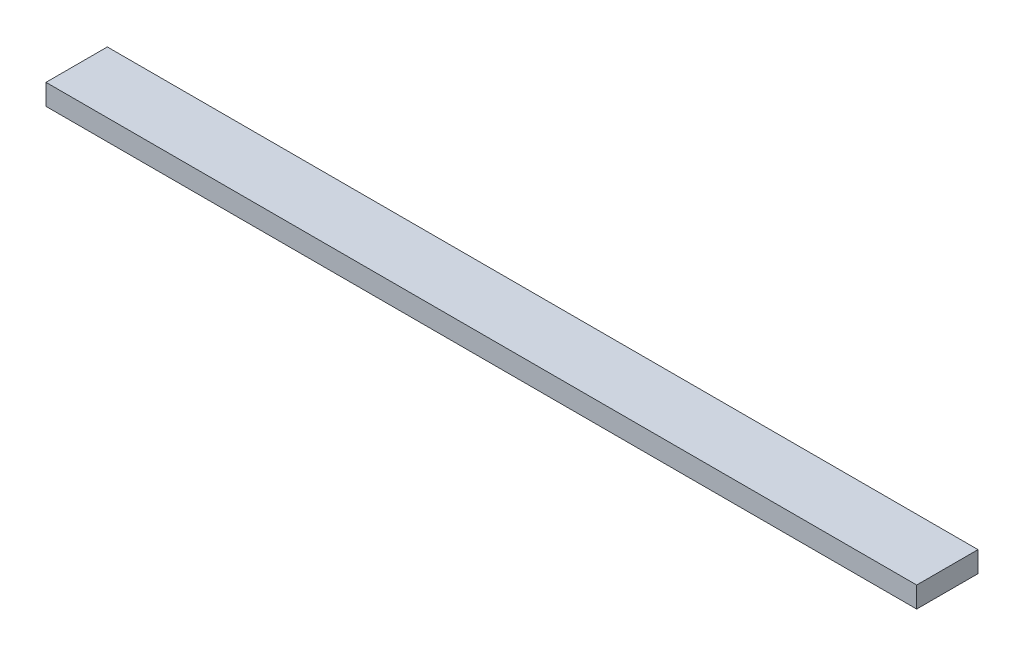
from build123d import *

# Parameters (mm, degrees)
SKETCH1_W           = 71
SKETCH1_H           = 1.7
BOSS_EXTRUDE1_DEPTH = 5


with BuildPart() as part:
    # Sketch1 → Boss-Extrude1 (new body)
    with BuildSketch(Plane.XY):
        Rectangle(SKETCH1_W, SKETCH1_H)
    extrude(amount=BOSS_EXTRUDE1_DEPTH)


solid = part.part
